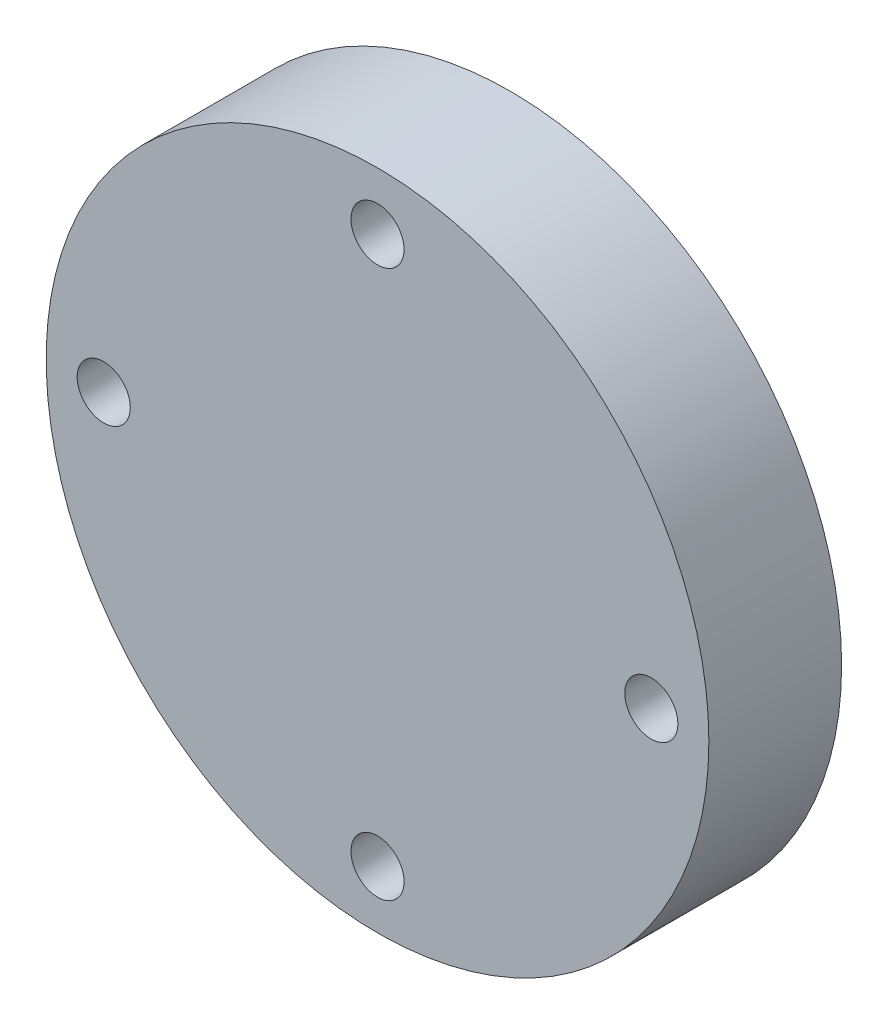
from build123d import *

# Parameters (mm, degrees)
SKETCH2_R           = 19.968626967
SKETCH2_R_2         = 1.6
BOSS_EXTRUDE1_DEPTH = 8


with BuildPart() as part:
    # Sketch2 → Boss-Extrude1 (new body)
    with BuildSketch(Plane.XY):
        Circle(SKETCH2_R)
        with Locations((0, -16.5)):
            Circle(SKETCH2_R_2, mode=Mode.SUBTRACT)
        with Locations((-16.5, 0)):
            Circle(SKETCH2_R_2, mode=Mode.SUBTRACT)
        with Locations((0, 16.5)):
            Circle(SKETCH2_R_2, mode=Mode.SUBTRACT)
        with Locations((16.5, 0)):
            Circle(SKETCH2_R_2, mode=Mode.SUBTRACT)
    extrude(amount=BOSS_EXTRUDE1_DEPTH)


solid = part.part
